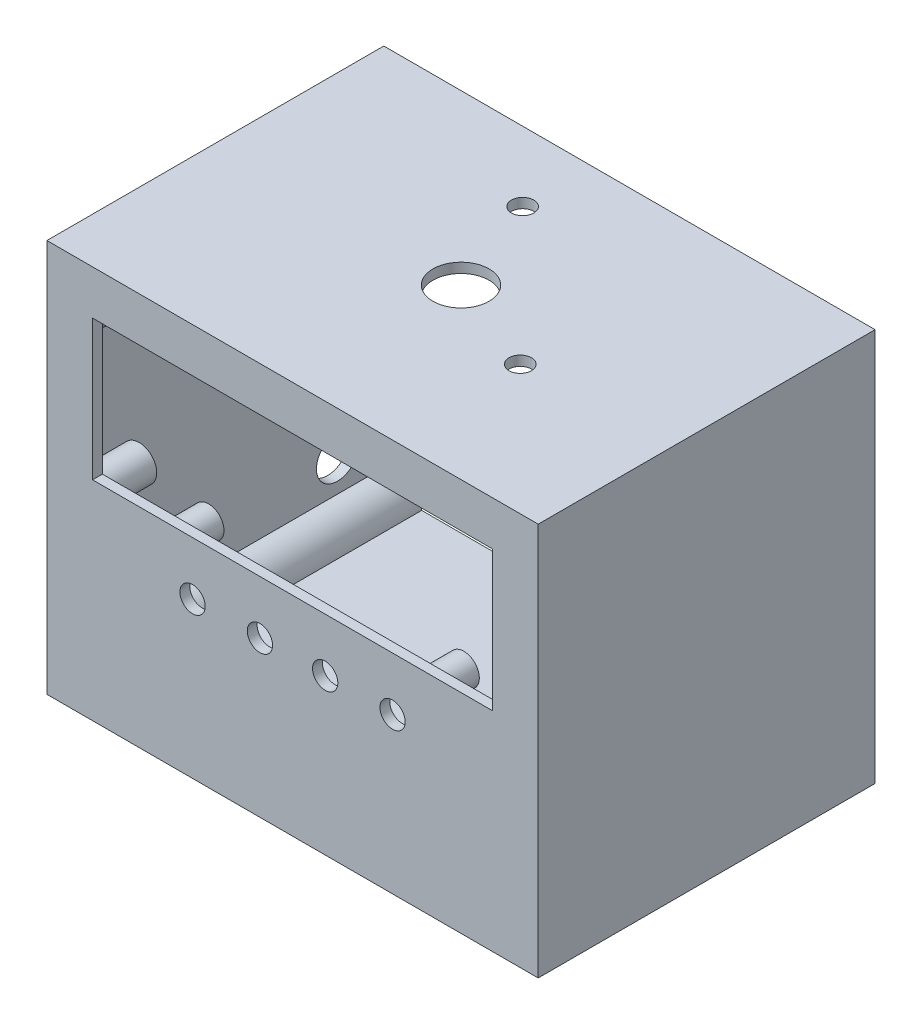
from build123d import *

# Parameters (mm, degrees)
SKETCH1_W           = 88.9
SKETCH1_H           = 71.12
BOSS_EXTRUDE1_DEPTH = 60.96
SKETCH2_W           = 85.344
SKETCH2_H           = 67.564
CUT_EXTRUDE1_DEPTH  = 59.182
SKETCH3_R           = 2.286
CUT_EXTRUDE2_DEPTH  = 5.08
SKETCH4_R           = 2.794
BOSS_EXTRUDE2_DEPTH = 6.1214
SKETCH5_R           = 1.27
CUT_EXTRUDE3_DEPTH  = 3.81
SKETCH7_W           = 72.39
SKETCH7_H           = 25.3492
CUT_EXTRUDE5_DEPTH  = 4.699
SKETCH8_R           = 3.175
BOSS_EXTRUDE3_DEPTH = 7.999555
SKETCH9_R           = 1.27
CUT_EXTRUDE6_DEPTH  = 3.81
SKETCH11_R          = 2.032
SKETCH11_R_2        = 5.08
CUT_EXTRUDE7_DEPTH  = 5.08
SKETCH12_R          = 3.81
CUT_EXTRUDE8_DEPTH  = 3.302
BOSS_EXTRUDE4_DEPTH = 59.182
SKETCH14_R          = 1.27
CUT_EXTRUDE9_DEPTH  = 3.81


with BuildPart() as part:
    # Sketch1 → Boss-Extrude1 (new body)
    with BuildSketch(Plane.XY):
        Rectangle(SKETCH1_W, SKETCH1_H)
    extrude(amount=BOSS_EXTRUDE1_DEPTH)

    # Sketch2 → Cut-Extrude1 (cut)
    with BuildSketch(Plane(origin=(0, 0, 0), x_dir=(-1, 0, 0), z_dir=(0, 0, -1))):
        Rectangle(SKETCH2_W, SKETCH2_H)
    extrude(amount=-CUT_EXTRUDE1_DEPTH, mode=Mode.SUBTRACT)

    # Sketch3 → Cut-Extrude2 (cut)
    with BuildSketch(Plane.XY.offset(60.96)):
        with Locations((-18.0975, -7.4676)):
            Circle(SKETCH3_R)
        with Locations((-5.9055, -7.4676)):
            Circle(SKETCH3_R)
        with Locations((5.9055, -7.4676)):
            Circle(SKETCH3_R)
        with Locations((18.0975, -7.4676)):
            Circle(SKETCH3_R)
    extrude(amount=-CUT_EXTRUDE2_DEPTH, mode=Mode.SUBTRACT)

    # Sketch4 → Boss-Extrude2 (add)
    with BuildSketch(Plane(origin=(0, 0, 59.182), x_dir=(-1, 0, 0), z_dir=(0, 0, -1))):
        with Locations((-23.1013, -1.778)):
            Circle(SKETCH4_R)
        with Locations((23.1013, -1.778)):
            Circle(SKETCH4_R)
        with Locations((23.1013, -30.0228)):
            Circle(SKETCH4_R)
        with Locations((-23.1013, -30.0228)):
            Circle(SKETCH4_R)
    extrude(amount=BOSS_EXTRUDE2_DEPTH)

    # Sketch5 → Cut-Extrude3 (cut)
    with BuildSketch(Plane(origin=(0, 0, 53.0606), x_dir=(-1, 0, 0), z_dir=(0, 0, -1))):
        with Locations((-23.1013, -1.778)):
            Circle(SKETCH5_R)
        with Locations((23.1013, -1.778)):
            Circle(SKETCH5_R)
        with Locations((23.1013, -30.0228)):
            Circle(SKETCH5_R)
        with Locations((-23.1013, -30.0228)):
            Circle(SKETCH5_R)
    extrude(amount=-CUT_EXTRUDE3_DEPTH, mode=Mode.SUBTRACT)

    # Sketch7 → Cut-Extrude5 (cut)
    with BuildSketch(Plane.XY.offset(60.96)):
        with Locations((0, 14.862768706)):
            Rectangle(SKETCH7_W, SKETCH7_H)
    extrude(amount=-CUT_EXTRUDE5_DEPTH, mode=Mode.SUBTRACT)

    # Sketch8 → Boss-Extrude3 (add)
    with BuildSketch(Plane(origin=(0, 0, 59.182), x_dir=(-1, 0, 0), z_dir=(0, 0, -1))):
        with Locations((-37.5285, 30.5435)):
            Circle(SKETCH8_R)
        with Locations((37.5285, 30.5435)):
            Circle(SKETCH8_R)
        with Locations((37.5285, -0.6985)):
            Circle(SKETCH8_R)
        with Locations((-37.5285, -0.6985)):
            Circle(SKETCH8_R)
    extrude(amount=BOSS_EXTRUDE3_DEPTH)

    # Sketch9 → Cut-Extrude6 (cut)
    with BuildSketch(Plane(origin=(0, 0, 51.182445152), x_dir=(-1, 0, 0), z_dir=(0, 0, -1))):
        with Locations((-37.5285, 30.5435)):
            Circle(SKETCH9_R)
        with Locations((37.5285, 30.5435)):
            Circle(SKETCH9_R)
        with Locations((37.5285, -0.6985)):
            Circle(SKETCH9_R)
        with Locations((-37.5285, -0.6985)):
            Circle(SKETCH9_R)
    extrude(amount=-CUT_EXTRUDE6_DEPTH, mode=Mode.SUBTRACT)

    # Sketch11 → Cut-Extrude7 (cut)
    with BuildSketch(Plane(origin=(0, 35.56, 0), x_dir=(1, 0, 0), z_dir=(0, 1, 0))):
        with Locations(Location((-6.732036627, -12.594763228, 0), (0, 0, 270))):
            Circle(SKETCH11_R)
        with Locations(Location((17.765022524, -37.523151726, 0), (0, 0, 270))):
            Circle(SKETCH11_R)
        with Locations(Location((0, -30.48, 0), (0, 0, 270))):
            Circle(SKETCH11_R_2)
    extrude(amount=-CUT_EXTRUDE7_DEPTH, mode=Mode.SUBTRACT)

    # Sketch12 → Cut-Extrude8 (cut)
    with BuildSketch(Plane.ZY.offset(44.45)):
        with Locations((10.16, -22.86)):
            Circle(SKETCH12_R)
    extrude(amount=-CUT_EXTRUDE8_DEPTH, mode=Mode.SUBTRACT)

    # Sketch13 → Boss-Extrude4 (add)
    with BuildSketch(Plane(origin=(0, 0, 59.182), x_dir=(-1, 0, 0), z_dir=(0, 0, -1))):
        with BuildLine():
            Line((42.672, 25.346634714), (42.672, 19.209934994))
            ThreePointArc((42.672, 19.209934994), (40.312998858, 22.278284854), (42.672, 25.346634714))
        make_face()
        with BuildLine():
            Line((44.45, -29.023311525), (44.45, -35.56))
            Line((44.45, -35.56), (37.913311525, -35.56))
            ThreePointArc((37.913311525, -35.56), (39.079897552, -30.189897552), (44.45, -29.023311525))
        make_face()
        with BuildLine():
            Line((-42.672, 25.346634714), (-42.672, 19.209934994))
            ThreePointArc((-42.672, 19.209934994), (-40.312998858, 22.278284854), (-42.672, 25.346634714))
        make_face()
        with BuildLine():
            Line((-44.45, -29.023311525), (-44.45, -35.56))
            Line((-44.45, -35.56), (-37.913311525, -35.56))
            ThreePointArc((-37.913311525, -35.56), (-39.079897552, -30.189897552), (-44.45, -29.023311525))
        make_face()
    extrude(amount=BOSS_EXTRUDE4_DEPTH)

    # Sketch14 → Cut-Extrude9 (cut)
    with BuildSketch(Plane(origin=(0, 0, 0), x_dir=(-1, 0, 0), z_dir=(0, 0, -1))):
        with Locations((-42.344998858, 22.278284854)):
            Circle(SKETCH14_R)
        with Locations((-41.275, -32.385)):
            Circle(SKETCH14_R)
        with Locations((41.275, -32.385)):
            Circle(SKETCH14_R)
        with Locations((42.344998858, 22.278284854)):
            Circle(SKETCH14_R)
    extrude(amount=-CUT_EXTRUDE9_DEPTH, mode=Mode.SUBTRACT)


solid = part.part
